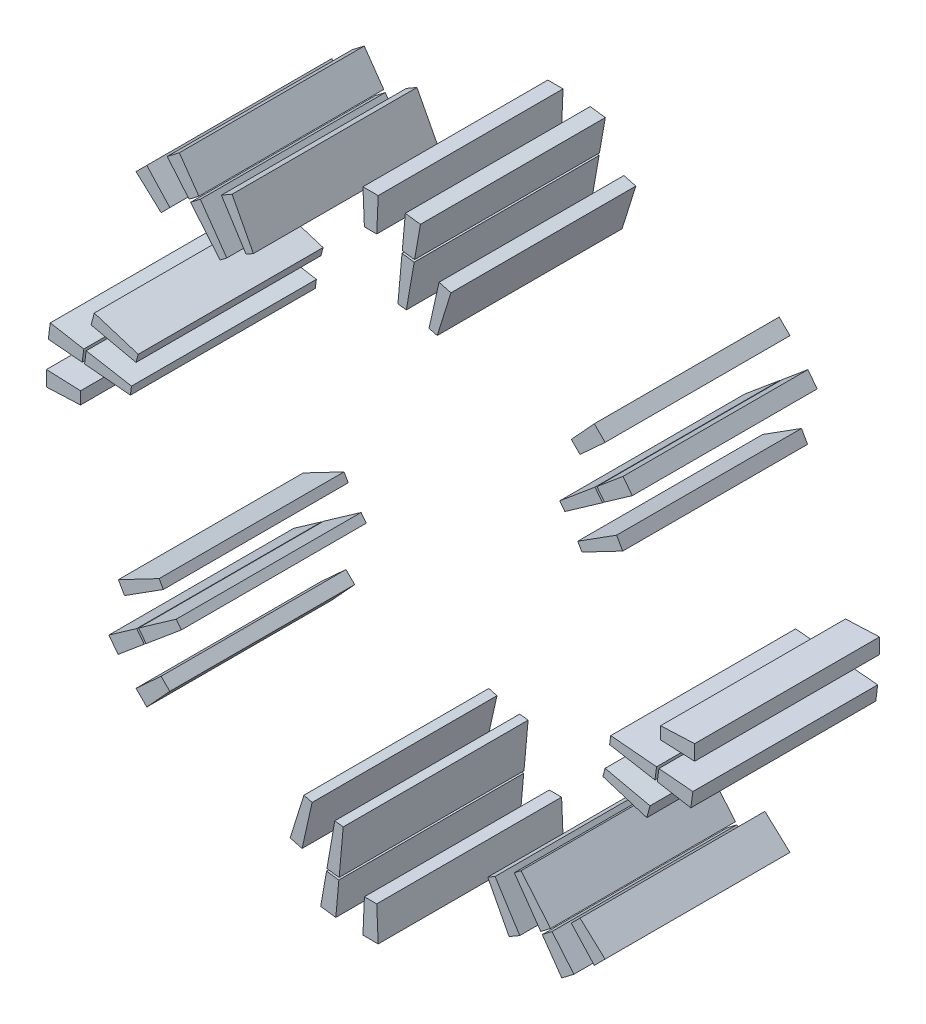
from build123d import *

# Parameters (mm, degrees)
SLOT_COPPER_ENVELOPES_START    = -15
SLOT_COPPER_ENVELOPES_DEPTH    = 30
SLOT_COPPER_ENVELOPES_2_DEPTH  = 30
SLOT_COPPER_ENVELOPES_3_DEPTH  = 30
SLOT_COPPER_ENVELOPES_4_DEPTH  = 30
SLOT_COPPER_ENVELOPES_5_DEPTH  = 30
SLOT_COPPER_ENVELOPES_6_DEPTH  = 30
SLOT_COPPER_ENVELOPES_7_DEPTH  = 30
SLOT_COPPER_ENVELOPES_8_DEPTH  = 30
SLOT_COPPER_ENVELOPES_9_DEPTH  = 30
SLOT_COPPER_ENVELOPES_10_DEPTH = 30
SLOT_COPPER_ENVELOPES_11_DEPTH = 30
SLOT_COPPER_ENVELOPES_12_DEPTH = 30
SLOT_COPPER_ENVELOPES_13_DEPTH = 30
SLOT_COPPER_ENVELOPES_14_DEPTH = 30
SLOT_COPPER_ENVELOPES_15_DEPTH = 30
SLOT_COPPER_ENVELOPES_16_DEPTH = 30
SLOT_COPPER_ENVELOPES_17_DEPTH = 30
SLOT_COPPER_ENVELOPES_18_DEPTH = 30
SLOT_COPPER_ENVELOPES_19_DEPTH = 30
SLOT_COPPER_ENVELOPES_20_DEPTH = 30
SLOT_COPPER_ENVELOPES_21_DEPTH = 30
SLOT_COPPER_ENVELOPES_22_DEPTH = 30
SLOT_COPPER_ENVELOPES_23_DEPTH = 30
SLOT_COPPER_ENVELOPES_24_DEPTH = 30
SLOT_COPPER_ENVELOPES_25_DEPTH = 30
SLOT_COPPER_ENVELOPES_26_DEPTH = 30
SLOT_COPPER_ENVELOPES_27_DEPTH = 30
SLOT_COPPER_ENVELOPES_28_DEPTH = 30
SLOT_COPPER_ENVELOPES_29_DEPTH = 30
SLOT_COPPER_ENVELOPES_30_DEPTH = 30
SLOT_COPPER_ENVELOPES_31_DEPTH = 30
SLOT_COPPER_ENVELOPES_32_DEPTH = 30


with BuildPart() as part:
    # Эскиз1 → Slot_copper_envelopes (new body)
    with BuildSketch(Plane.XY.offset(SLOT_COPPER_ENVELOPES_START)):
        Polygon((47.066283251, -1.000833333), (52.584615385, -1.2375), (52.584615385, 1.2375), (47.066283251, 1.000833333), align=None)
    extrude(amount=SLOT_COPPER_ENVELOPES_DEPTH)


with BuildPart() as body_2:
    # Эскиз1 → Slot_copper_envelopes 2 (new body)
    with BuildSketch(Plane.XY.offset(SLOT_COPPER_ENVELOPES_START)):
        Polygon((34.306712625, 19.013133149), (40.923817822, 22.471714447), (39.922984488, 24.20520863), (33.619212625, 20.203918079), align=None)
    extrude(amount=SLOT_COPPER_ENVELOPES_2_DEPTH)


with BuildPart() as body_3:
    # Эскиз1 → Slot_copper_envelopes 3 (new body)
    with BuildSketch(Plane.XY.offset(SLOT_COPPER_ENVELOPES_START)):
        Polygon((37.949461762, 27.858123382), (42.471522532, 31.029710847), (40.964837995, 32.993260364), (36.730924302, 29.446152318), align=None)
    extrude(amount=SLOT_COPPER_ENVELOPES_3_DEPTH)


with BuildPart() as body_4:
    # Эскиз1 → Slot_copper_envelopes 4 (new body)
    with BuildSketch(Plane.XY.offset(SLOT_COPPER_ENVELOPES_START)):
        Polygon((31.531502071, 23.328397726), (37.640561568, 27.621095926), (36.422024107, 29.209124862), (30.694455106, 24.419258569), align=None)
    extrude(amount=SLOT_COPPER_ENVELOPES_4_DEPTH)


with BuildPart() as body_5:
    # Эскиз1 → Slot_copper_envelopes 5 (new body)
    with BuildSketch(Plane.XY.offset(SLOT_COPPER_ENVELOPES_START)):
        Polygon((33.988584089, 32.573192015), (38.057982766, 36.307893483), (36.307893483, 38.057982766), (32.573192015, 33.988584089), align=None)
    extrude(amount=SLOT_COPPER_ENVELOPES_5_DEPTH)


with BuildPart() as body_6:
    # Эскиз1 → Slot_copper_envelopes 6 (new body)
    with BuildSketch(Plane.XY.offset(SLOT_COPPER_ENVELOPES_START)):
        Polygon((10.814193756, 37.702824519), (13.047607424, 44.827410764), (11.114145895, 45.345480219), (9.486045745, 38.058700706), align=None)
    extrude(amount=SLOT_COPPER_ENVELOPES_6_DEPTH)


with BuildPart() as body_7:
    # Эскиз1 → Slot_copper_envelopes 7 (new body)
    with BuildSketch(Plane.XY.offset(SLOT_COPPER_ENVELOPES_START)):
        Polygon((7.1356538, 46.532989709), (8.090582631, 51.973220548), (5.6367566, 52.296272873), (5.151111669, 46.794259637), align=None)
    extrude(amount=SLOT_COPPER_ENVELOPES_7_DEPTH)


with BuildPart() as body_8:
    # Эскиз1 → Slot_copper_envelopes 8 (new body)
    with BuildSketch(Plane.XY.offset(SLOT_COPPER_ENVELOPES_START)):
        Polygon((5.800470709, 38.791807162), (7.084832099, 46.146960565), (5.100289968, 46.408230493), (4.437234025, 38.971280676), align=None)
    extrude(amount=SLOT_COPPER_ENVELOPES_8_DEPTH)


with BuildPart() as body_9:
    # Эскиз1 → Slot_copper_envelopes 9 (new body)
    with BuildSketch(Plane.XY.offset(SLOT_COPPER_ENVELOPES_START)):
        Polygon((1.000833333, 47.066283251), (1.2375, 52.584615385), (-1.2375, 52.584615385), (-1.000833333, 47.066283251), align=None)
    extrude(amount=SLOT_COPPER_ENVELOPES_9_DEPTH)


with BuildPart() as body_10:
    # Эскиз1 → Slot_copper_envelopes 10 (new body)
    with BuildSketch(Plane.XY.offset(SLOT_COPPER_ENVELOPES_START)):
        Polygon((-19.013133149, 34.306712625), (-22.471714447, 40.923817822), (-24.20520863, 39.922984488), (-20.203918079, 33.619212625), align=None)
    extrude(amount=SLOT_COPPER_ENVELOPES_10_DEPTH)


with BuildPart() as body_11:
    # Эскиз1 → Slot_copper_envelopes 11 (new body)
    with BuildSketch(Plane.XY.offset(SLOT_COPPER_ENVELOPES_START)):
        Polygon((-27.858123382, 37.949461762), (-31.029710847, 42.471522532), (-32.993260364, 40.964837995), (-29.446152318, 36.730924302), align=None)
    extrude(amount=SLOT_COPPER_ENVELOPES_11_DEPTH)


with BuildPart() as body_12:
    # Эскиз1 → Slot_copper_envelopes 12 (new body)
    with BuildSketch(Plane.XY.offset(SLOT_COPPER_ENVELOPES_START)):
        Polygon((-23.328397726, 31.531502071), (-27.621095926, 37.640561568), (-29.209124862, 36.422024107), (-24.419258569, 30.694455106), align=None)
    extrude(amount=SLOT_COPPER_ENVELOPES_12_DEPTH)


with BuildPart() as body_13:
    # Эскиз1 → Slot_copper_envelopes 13 (new body)
    with BuildSketch(Plane.XY.offset(SLOT_COPPER_ENVELOPES_START)):
        Polygon((-32.573192015, 33.988584089), (-36.307893483, 38.057982766), (-38.057982766, 36.307893483), (-33.988584089, 32.573192015), align=None)
    extrude(amount=SLOT_COPPER_ENVELOPES_13_DEPTH)


with BuildPart() as body_14:
    # Эскиз1 → Slot_copper_envelopes 14 (new body)
    with BuildSketch(Plane.XY.offset(SLOT_COPPER_ENVELOPES_START)):
        Polygon((-37.702824519, 10.814193756), (-44.827410764, 13.047607424), (-45.345480219, 11.114145895), (-38.058700706, 9.486045745), align=None)
    extrude(amount=SLOT_COPPER_ENVELOPES_14_DEPTH)


with BuildPart() as body_15:
    # Эскиз1 → Slot_copper_envelopes 15 (new body)
    with BuildSketch(Plane.XY.offset(SLOT_COPPER_ENVELOPES_START)):
        Polygon((-46.532989709, 7.1356538), (-51.973220548, 8.090582631), (-52.296272873, 5.6367566), (-46.794259637, 5.151111669), align=None)
    extrude(amount=SLOT_COPPER_ENVELOPES_15_DEPTH)


with BuildPart() as body_16:
    # Эскиз1 → Slot_copper_envelopes 16 (new body)
    with BuildSketch(Plane.XY.offset(SLOT_COPPER_ENVELOPES_START)):
        Polygon((-38.791807162, 5.800470709), (-46.146960565, 7.084832099), (-46.408230493, 5.100289968), (-38.971280676, 4.437234025), align=None)
    extrude(amount=SLOT_COPPER_ENVELOPES_16_DEPTH)


with BuildPart() as body_17:
    # Эскиз1 → Slot_copper_envelopes 17 (new body)
    with BuildSketch(Plane.XY.offset(SLOT_COPPER_ENVELOPES_START)):
        Polygon((-47.066283251, 1.000833333), (-52.584615385, 1.2375), (-52.584615385, -1.2375), (-47.066283251, -1.000833333), align=None)
    extrude(amount=SLOT_COPPER_ENVELOPES_17_DEPTH)


with BuildPart() as body_18:
    # Эскиз1 → Slot_copper_envelopes 18 (new body)
    with BuildSketch(Plane.XY.offset(SLOT_COPPER_ENVELOPES_START)):
        Polygon((-34.306712625, -19.013133149), (-40.923817822, -22.471714447), (-39.922984488, -24.20520863), (-33.619212625, -20.203918079), align=None)
    extrude(amount=SLOT_COPPER_ENVELOPES_18_DEPTH)


with BuildPart() as body_19:
    # Эскиз1 → Slot_copper_envelopes 19 (new body)
    with BuildSketch(Plane.XY.offset(SLOT_COPPER_ENVELOPES_START)):
        Polygon((-37.949461762, -27.858123382), (-42.471522532, -31.029710847), (-40.964837995, -32.993260364), (-36.730924302, -29.446152318), align=None)
    extrude(amount=SLOT_COPPER_ENVELOPES_19_DEPTH)


with BuildPart() as body_20:
    # Эскиз1 → Slot_copper_envelopes 20 (new body)
    with BuildSketch(Plane.XY.offset(SLOT_COPPER_ENVELOPES_START)):
        Polygon((-31.531502071, -23.328397726), (-37.640561568, -27.621095926), (-36.422024107, -29.209124862), (-30.694455106, -24.419258569), align=None)
    extrude(amount=SLOT_COPPER_ENVELOPES_20_DEPTH)


with BuildPart() as body_21:
    # Эскиз1 → Slot_copper_envelopes 21 (new body)
    with BuildSketch(Plane.XY.offset(SLOT_COPPER_ENVELOPES_START)):
        Polygon((-33.988584089, -32.573192015), (-38.057982766, -36.307893483), (-36.307893483, -38.057982766), (-32.573192015, -33.988584089), align=None)
    extrude(amount=SLOT_COPPER_ENVELOPES_21_DEPTH)


with BuildPart() as body_22:
    # Эскиз1 → Slot_copper_envelopes 22 (new body)
    with BuildSketch(Plane.XY.offset(SLOT_COPPER_ENVELOPES_START)):
        Polygon((-10.814193756, -37.702824519), (-13.047607424, -44.827410764), (-11.114145895, -45.345480219), (-9.486045745, -38.058700706), align=None)
    extrude(amount=SLOT_COPPER_ENVELOPES_22_DEPTH)


with BuildPart() as body_23:
    # Эскиз1 → Slot_copper_envelopes 23 (new body)
    with BuildSketch(Plane.XY.offset(SLOT_COPPER_ENVELOPES_START)):
        Polygon((-7.1356538, -46.532989709), (-8.090582631, -51.973220548), (-5.6367566, -52.296272873), (-5.151111669, -46.794259637), align=None)
    extrude(amount=SLOT_COPPER_ENVELOPES_23_DEPTH)


with BuildPart() as body_24:
    # Эскиз1 → Slot_copper_envelopes 24 (new body)
    with BuildSketch(Plane.XY.offset(SLOT_COPPER_ENVELOPES_START)):
        Polygon((-5.800470709, -38.791807162), (-7.084832099, -46.146960565), (-5.100289968, -46.408230493), (-4.437234025, -38.971280676), align=None)
    extrude(amount=SLOT_COPPER_ENVELOPES_24_DEPTH)


with BuildPart() as body_25:
    # Эскиз1 → Slot_copper_envelopes 25 (new body)
    with BuildSketch(Plane.XY.offset(SLOT_COPPER_ENVELOPES_START)):
        Polygon((-1.000833333, -47.066283251), (-1.2375, -52.584615385), (1.2375, -52.584615385), (1.000833333, -47.066283251), align=None)
    extrude(amount=SLOT_COPPER_ENVELOPES_25_DEPTH)


with BuildPart() as body_26:
    # Эскиз1 → Slot_copper_envelopes 26 (new body)
    with BuildSketch(Plane.XY.offset(SLOT_COPPER_ENVELOPES_START)):
        Polygon((19.013133149, -34.306712625), (22.471714447, -40.923817822), (24.20520863, -39.922984488), (20.203918079, -33.619212625), align=None)
    extrude(amount=SLOT_COPPER_ENVELOPES_26_DEPTH)


with BuildPart() as body_27:
    # Эскиз1 → Slot_copper_envelopes 27 (new body)
    with BuildSketch(Plane.XY.offset(SLOT_COPPER_ENVELOPES_START)):
        Polygon((27.858123382, -37.949461762), (31.029710847, -42.471522532), (32.993260364, -40.964837995), (29.446152318, -36.730924302), align=None)
    extrude(amount=SLOT_COPPER_ENVELOPES_27_DEPTH)


with BuildPart() as body_28:
    # Эскиз1 → Slot_copper_envelopes 28 (new body)
    with BuildSketch(Plane.XY.offset(SLOT_COPPER_ENVELOPES_START)):
        Polygon((23.328397726, -31.531502071), (27.621095926, -37.640561568), (29.209124862, -36.422024107), (24.419258569, -30.694455106), align=None)
    extrude(amount=SLOT_COPPER_ENVELOPES_28_DEPTH)


with BuildPart() as body_29:
    # Эскиз1 → Slot_copper_envelopes 29 (new body)
    with BuildSketch(Plane.XY.offset(SLOT_COPPER_ENVELOPES_START)):
        Polygon((32.573192015, -33.988584089), (36.307893483, -38.057982766), (38.057982766, -36.307893483), (33.988584089, -32.573192015), align=None)
    extrude(amount=SLOT_COPPER_ENVELOPES_29_DEPTH)


with BuildPart() as body_30:
    # Эскиз1 → Slot_copper_envelopes 30 (new body)
    with BuildSketch(Plane.XY.offset(SLOT_COPPER_ENVELOPES_START)):
        Polygon((37.702824519, -10.814193756), (44.827410764, -13.047607424), (45.345480219, -11.114145895), (38.058700706, -9.486045745), align=None)
    extrude(amount=SLOT_COPPER_ENVELOPES_30_DEPTH)


with BuildPart() as body_31:
    # Эскиз1 → Slot_copper_envelopes 31 (new body)
    with BuildSketch(Plane.XY.offset(SLOT_COPPER_ENVELOPES_START)):
        Polygon((46.532989709, -7.1356538), (51.973220548, -8.090582631), (52.296272873, -5.6367566), (46.794259637, -5.151111669), align=None)
    extrude(amount=SLOT_COPPER_ENVELOPES_31_DEPTH)


with BuildPart() as body_32:
    # Эскиз1 → Slot_copper_envelopes 32 (new body)
    with BuildSketch(Plane.XY.offset(SLOT_COPPER_ENVELOPES_START)):
        Polygon((38.791807162, -5.800470709), (46.146960565, -7.084832099), (46.408230493, -5.100289968), (38.971280676, -4.437234025), align=None)
    extrude(amount=SLOT_COPPER_ENVELOPES_32_DEPTH)


solid = Compound([part.part, body_2.part, body_3.part, body_4.part, body_5.part, body_6.part, body_7.part, body_8.part, body_9.part, body_10.part, body_11.part, body_12.part, body_13.part, body_14.part, body_15.part, body_16.part, body_17.part, body_18.part, body_19.part, body_20.part, body_21.part, body_22.part, body_23.part, body_24.part, body_25.part, body_26.part, body_27.part, body_28.part, body_29.part, body_30.part, body_31.part, body_32.part])
